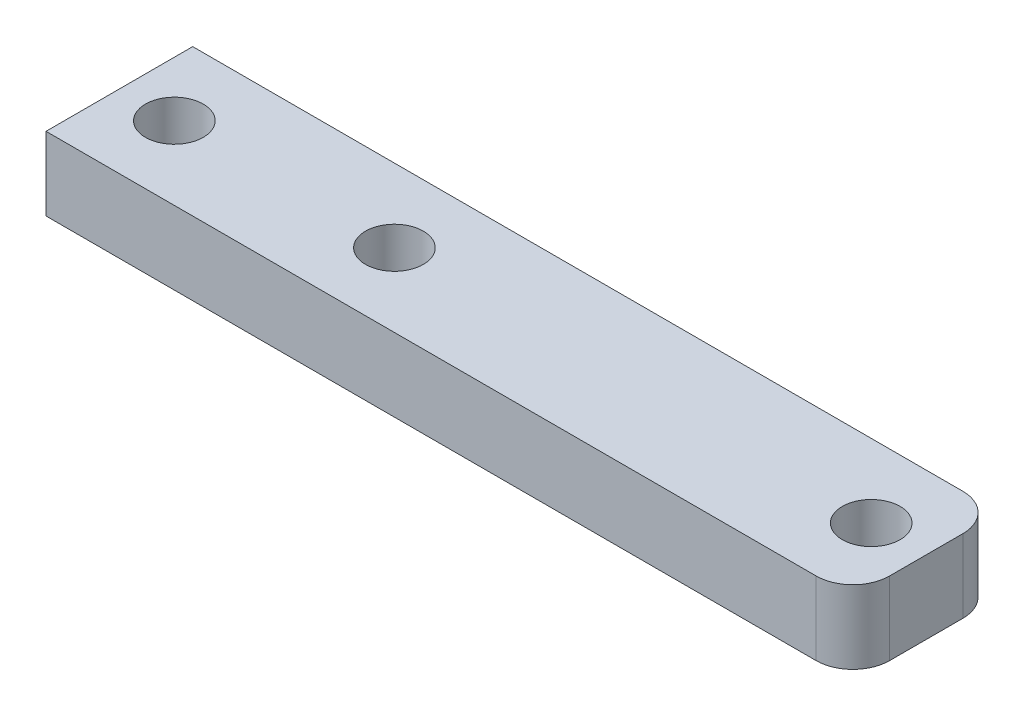
from build123d import *

# Parameters (mm, degrees)
SKETCH1_W             = 69.85
SKETCH1_H             = 12.7
BOSS_EXTRUDE1_DEPTH   = 6.35
M6X1_0_TAPPED_HOLE1_D = 5
FILLET1_R             = 3.175


with BuildPart() as part:
    # Sketch1 → Boss-Extrude1 (new body)
    with BuildSketch(Plane(origin=(0, 0, 0), x_dir=(1, 0, 0), z_dir=(0, 1, 0))):
        with Locations((34.925, 0)):
            Rectangle(SKETCH1_W, SKETCH1_H)
    extrude(amount=BOSS_EXTRUDE1_DEPTH)

    # M6x1.0 Tapped Hole1 (through all)
    with Locations(Plane(origin=(0, 6.35, 0), x_dir=(1, 0, 0), z_dir=(0, 1, 0))):
        with Locations((4.7625, 0), (23.8125, 0), (65.0875, 0)):
            Hole(M6X1_0_TAPPED_HOLE1_D / 2)

    # Fillet1
    fillet1_edges = [part.edges().sort_by_distance(p)[0] for p in [
        (69.85, 3.175, -6.35),
        (69.85, 3.175, 6.35),
    ]]
    fillet(fillet1_edges, radius=FILLET1_R)


solid = part.part
